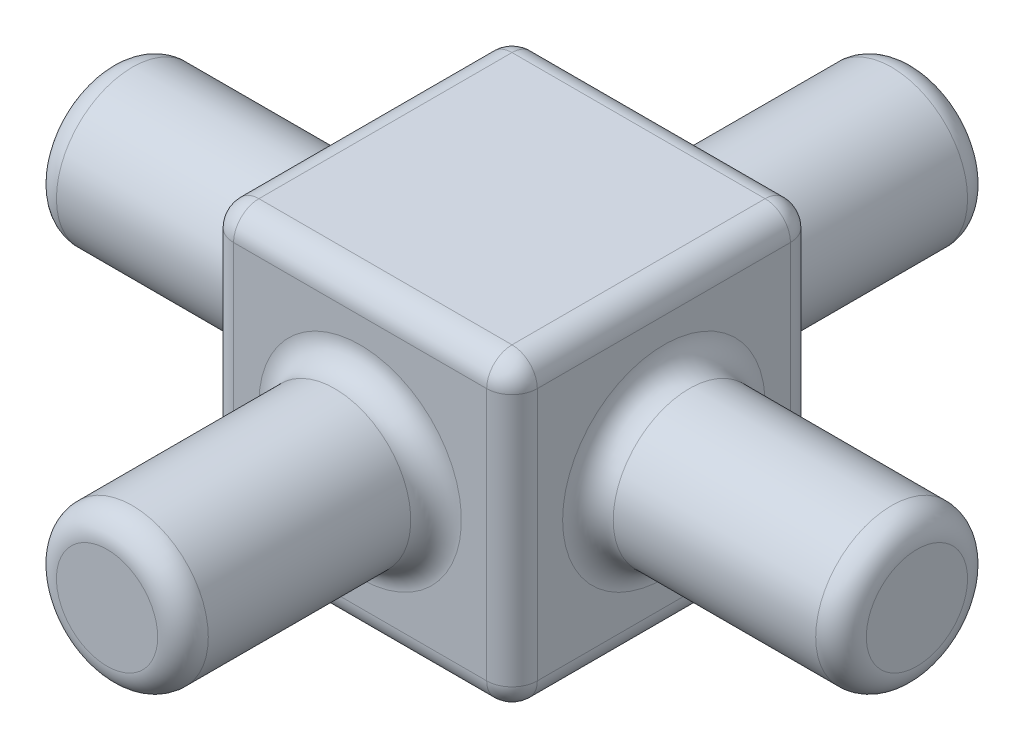
from build123d import *

# Parameters (mm, degrees)
SKETCH_1_W               = 6
SKETCH_1_H               = 6
EXTRUDE_1_DEPTH          = 3
SKETCH_2_R               = 1.5
EXTRUDE_2_DEPTH          = 5
PATTERN_CIRCULAR_1_COUNT = 4
FILLET_1_R               = 0.5


with BuildPart() as part:
    # 草图1 → 凸台-拉伸1 (new, symmetric)
    with BuildSketch(Plane(origin=(0, 0, 0), x_dir=(1, 0, 0), z_dir=(0, 1, 0))):
        Rectangle(SKETCH_1_W, SKETCH_1_H)
    extrude(amount=EXTRUDE_1_DEPTH, both=True)

    # 草图2 → 凸台-拉伸2 (add)
    with BuildSketch(Plane.XY.offset(3)):
        Circle(SKETCH_2_R)
    extrude_2 = extrude(amount=EXTRUDE_2_DEPTH)

    # 阵列(圆周)1: 凸台-拉伸2 ×4 about axis
    pattern_circular_1_axis = Axis((0, 0, 0), (0, 1, 0))
    for i in range(1, PATTERN_CIRCULAR_1_COUNT):
        add(extrude_2.rotate(pattern_circular_1_axis, i * 360 / PATTERN_CIRCULAR_1_COUNT))

    # 圆角1
    fillet_1_edges = [part.edges().sort_by_distance(p)[0] for p in [
        (-8, 0, -1.5),
        (1.5, 0, -8),
        (-1.5, 0, 8),
        (8, 0, 1.5),
        (3, 0, 1.5),
        (0, -3, 3),
        (-3, -3, 0),
        (3, 0, -3),
        (3, -3, 0),
        (0, -3, -3),
        (1.5, 0, -3),
        (-3, 0, -3),
        (0, 3, -3),
        (-3, 3, 0),
        (-3, 0, 3),
        (-3, 0, -1.5),
        (-1.5, 0, 3),
        (3, 0, 3),
        (0, 3, 3),
        (3, 3, 0),
    ]]
    fillet(fillet_1_edges, radius=FILLET_1_R)


solid = part.part
